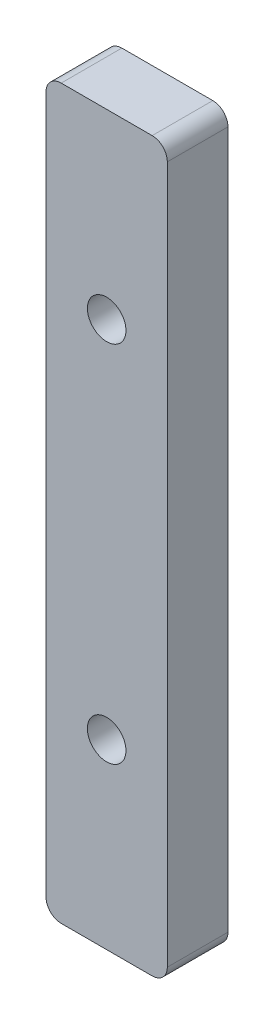
from build123d import *

# Parameters (mm, degrees)
SKETCH1_W                  = 12.7
SKETCH1_H                  = 76.2
EXTRUDE1_DEPTH             = 6.35
F_10_32_TAPPED_HOLE1_D     = 4.0386
F_10_32_TAPPED_HOLE1_DEPTH = 13.716
F_10_32_TAPPED_HOLE1_TIP   = 1.213317848
FILLET1_R                  = 1.5875


with BuildPart() as part:
    # Sketch1 → Extrude1 (new body)
    with BuildSketch(Plane.XY):
        with Locations((0, 38.1)):
            Rectangle(SKETCH1_W, SKETCH1_H)
    extrude(amount=-EXTRUDE1_DEPTH)

    # #10-32 Tapped Hole1
    with Locations(Plane.XY):
        with Locations((0, 57.15), (0, 19.05)):
            Hole(F_10_32_TAPPED_HOLE1_D / 2, depth=F_10_32_TAPPED_HOLE1_DEPTH)
            with Locations((0, 0, -(F_10_32_TAPPED_HOLE1_DEPTH + F_10_32_TAPPED_HOLE1_TIP / 2))):  # 118° drill point
                Cone(0, F_10_32_TAPPED_HOLE1_D / 2, F_10_32_TAPPED_HOLE1_TIP, mode=Mode.SUBTRACT)

    # Fillet1
    fillet1_edges = [part.edges().sort_by_distance(p)[0] for p in [
        (-6.35, 76.2, -3.175),
        (6.35, 76.2, -3.175),
        (6.35, 0, -3.175),
        (-6.35, 0, -3.175),
    ]]
    fillet(fillet1_edges, radius=FILLET1_R)


solid = part.part
